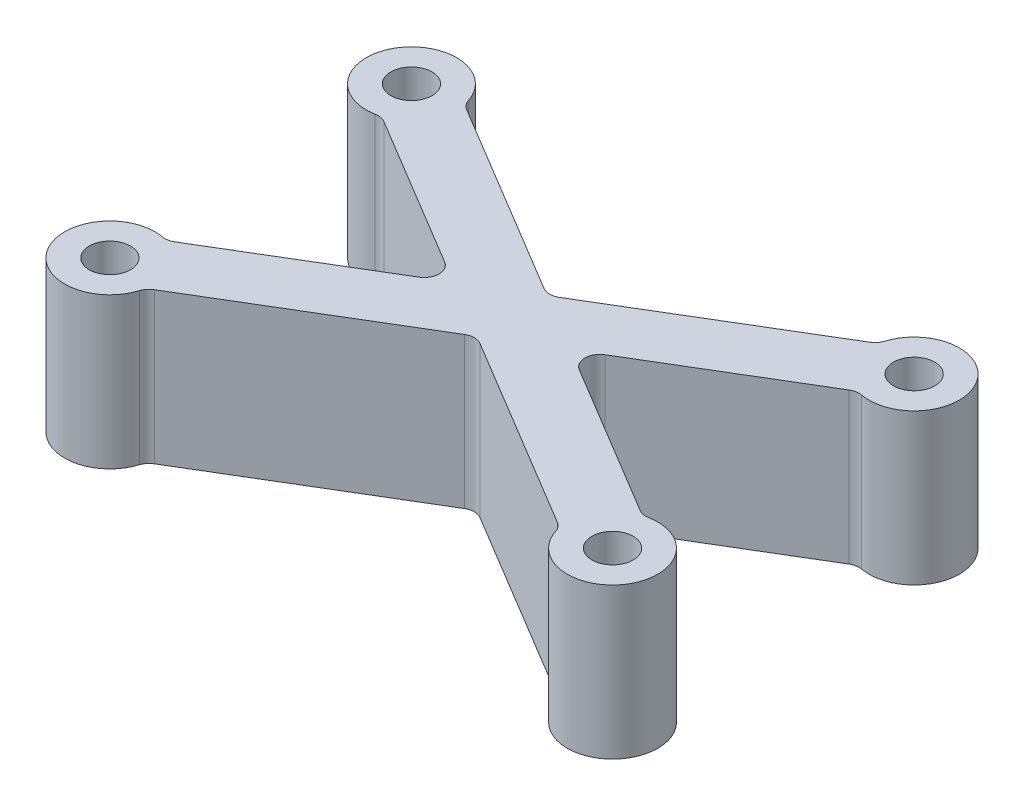
from build123d import *

# Parameters (mm, degrees)
SKETCH_1_R        = 4.5
SKETCH_1_R_2      = 2.05
EXTRUDE_1_DEPTH   = 15
EXTRUDE_1_2_DEPTH = 15
EXTRUDE_1_3_DEPTH = 15
EXTRUDE_1_4_DEPTH = 15
SKETCH_2_R        = 2.05
EXTRUDE_2_DEPTH   = 15
EXTRUDE_START     = -15
SKETCH_3_R        = 2.05
EXTRUDE_3_DEPTH   = 15
FILLET_1_R        = 1.5


with BuildPart() as part:
    # 草图1 → 凸台-拉伸1 (new body)
    with BuildSketch(Plane(origin=(0, 0, 0), x_dir=(1, 0, 0), z_dir=(0, 1, 0))):
        with Locations(Location((0, 0, 0), (0, 0, 270))):
            Circle(SKETCH_1_R)
        with Locations(Location((0, 0, 0), (0, 0, 270))):
            Circle(SKETCH_1_R_2, mode=Mode.SUBTRACT)
    extrude(amount=EXTRUDE_1_DEPTH)



with BuildPart() as body_2:
    # 草图1 → Extrude 1 2 (new body)
    with BuildSketch(Plane(origin=(0, 0, 0), x_dir=(1, 0, 0), z_dir=(0, 1, 0))):
        with Locations(Location((0, 30, 0), (0, 0, 270))):
            Circle(SKETCH_1_R)
        with Locations(Location((0, 30, 0), (0, 0, 270))):
            Circle(SKETCH_1_R_2, mode=Mode.SUBTRACT)
    extrude(amount=EXTRUDE_1_2_DEPTH)



with BuildPart() as body_3:
    # 草图1 → Extrude 1 3 (new body)
    with BuildSketch(Plane(origin=(0, 0, 0), x_dir=(1, 0, 0), z_dir=(0, 1, 0))):
        with Locations(Location((50, 30, 0), (0, 0, 270))):
            Circle(SKETCH_1_R)
        with Locations(Location((50, 30, 0), (0, 0, 270))):
            Circle(SKETCH_1_R_2, mode=Mode.SUBTRACT)
    extrude(amount=EXTRUDE_1_3_DEPTH)


with BuildPart() as body_4:
    # 草图1 → Extrude 1 4 (new body)
    with BuildSketch(Plane(origin=(0, 0, 0), x_dir=(1, 0, 0), z_dir=(0, 1, 0))):
        with Locations(Location((50, 0, 0), (0, 0, 270))):
            Circle(SKETCH_1_R)
        with Locations(Location((50, 0, 0), (0, 0, 270))):
            Circle(SKETCH_1_R_2, mode=Mode.SUBTRACT)
    extrude(amount=EXTRUDE_1_4_DEPTH)


with BuildPart() as body_2_1:
    add(body_2.part)

    add(body_4.part)  # 凸台-拉伸2 merges body 4
    # 草图2 → 凸台-拉伸2 (add)
    with BuildSketch(Plane(origin=(0, 15, 0), x_dir=(1, 0, 0), z_dir=(0, 1, 0))):
        with BuildLine():
            Line((51.543487266, 2.572478777), (1.543487266, 32.572478777))
            ThreePointArc((1.543487266, 32.572478777), (-2.572478777, 31.543487266), (-1.543487266, 27.427521223))
            Line((-1.543487266, 27.427521223), (48.456512734, -2.572478777))
            ThreePointArc((48.456512734, -2.572478777), (52.572478777, -1.543487266), (51.543487266, 2.572478777))
        make_face()
        with Locations(Location((0, 30, 0), (0, 0, 270))):
            Circle(SKETCH_2_R, mode=Mode.SUBTRACT)
        with Locations(Location((50, 0, 0), (0, 0, 270))):
            Circle(SKETCH_2_R, mode=Mode.SUBTRACT)
    extrude(amount=-EXTRUDE_2_DEPTH)


with BuildPart() as part_1:
    add(part.part)

    add(body_2_1.part)  # 凸台-拉伸3 merges body 2

    add(body_3.part)  # 凸台-拉伸3 merges body 3
    # 草图3 → 凸台-拉伸3 (add)
    with BuildSketch(Plane(origin=(0, 15, 0), x_dir=(1, 0, 0), z_dir=(0, 1, 0)).offset(EXTRUDE_START)):
        with BuildLine():
            Line((-1.543487266, 2.572478777), (48.456512734, 32.572478777))
            ThreePointArc((48.456512734, 32.572478777), (52.572478777, 31.543487266), (51.543487266, 27.427521223))
            Line((51.543487266, 27.427521223), (1.543487266, -2.572478777))
            ThreePointArc((1.543487266, -2.572478777), (-2.572478777, -1.543487266), (-1.543487266, 2.572478777))
        make_face()
        with Locations(Location((0, 0, 0), (0, 0, 270))):
            Circle(SKETCH_3_R, mode=Mode.SUBTRACT)
        with Locations(Location((50, 30, 0), (0, 0, 270))):
            Circle(SKETCH_3_R, mode=Mode.SUBTRACT)
    extrude(amount=EXTRUDE_3_DEPTH)

    # 圆角1
    fillet_1_edges = [part_1.edges().sort_by_distance(p)[0] for p in [
        (1.332631442, 7.5, -4.298150002),
        (4.419605974, 7.5, 0.846807552),
        (45.580394026, 7.5, -30.846807552),
        (48.667368558, 7.5, -25.701849998),
        (30.830951895, 7.5, -15),
        (48.667368558, 7.5, -4.298150002),
        (25, 7.5, -11.501428863),
        (45.580394026, 7.5, 0.846807552),
        (25, 7.5, -18.498571137),
        (19.169048105, 7.5, -15),
        (4.419605974, 7.5, -30.846807552),
        (1.332631442, 7.5, -25.701849998),
    ]]
    fillet(fillet_1_edges, radius=FILLET_1_R)


solid = part_1.part
